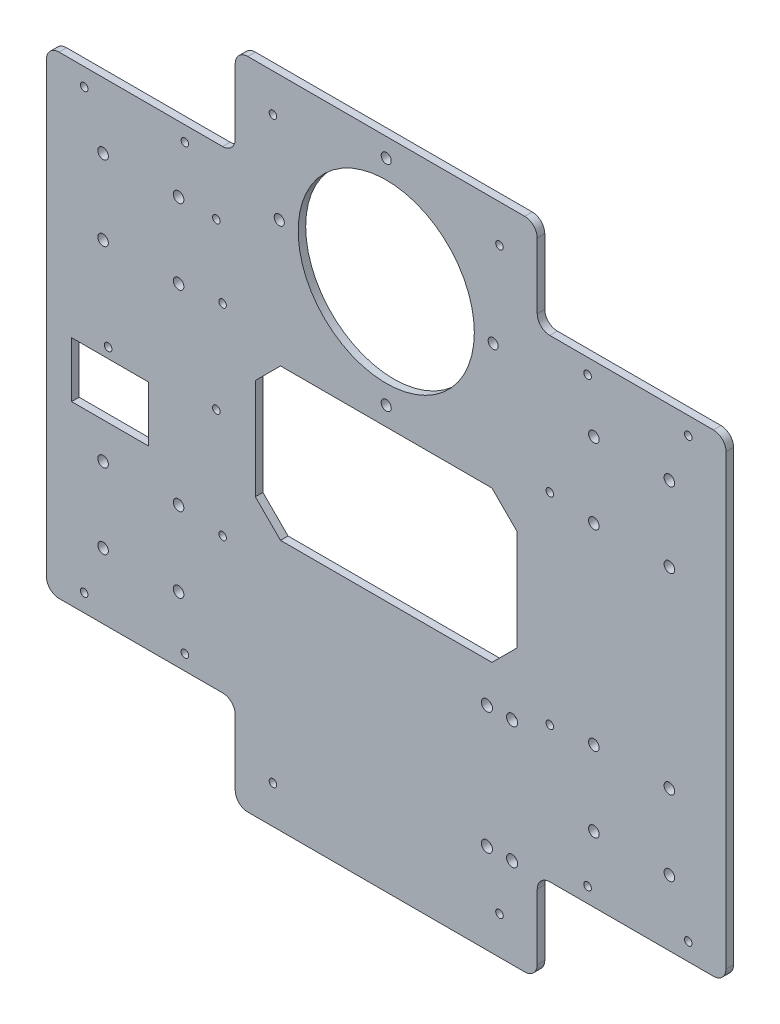
from build123d import *

# Parameters (mm, degrees)
SKETCH_1_W          = 270
SKETCH_1_H          = 260
EXTRUDE_1_DEPTH     = 3
CUT_EXTRUDE_1_REACH = 189.441
SKETCH_2_W          = 75
SKETCH_2_H          = 36
FILLET_1_R          = 5
SKETCH_3_R          = 35
CUT_EXTRUDE_2_DEPTH = 10
SKETCH_4_R          = 2.1
CUT_EXTRUDE_3_DEPTH = 4.55
SKETCH_5_R          = 1.5
SKETCH_5_R_2        = 2.2
CUT_EXTRUDE_4_DEPTH = 188.440657276
SKETCH_6_R          = 1.5
CUT_EXTRUDE_5_DEPTH = 188.440657276
SKETCH_7_R          = 1.5
CUT_EXTRUDE_6_DEPTH = 188.440657276
SKETCH_8_W          = 104
SKETCH_8_H          = 60
CUT_EXTRUDE_7_DEPTH = 188.440657276
CHAMFER_1_SIZE      = 10
SKETCH_9_R          = 2
CUT_EXTRUDE_8_DEPTH = 188.440657276
CUT_EXTRUDE_9_REACH = 189.441
SKETCH_11_W         = 30.5
SKETCH_11_H         = 22


with BuildPart() as part:
    # 草图1 → 凸台-拉伸1 (new body)
    with BuildSketch(Plane.XY):
        Rectangle(SKETCH_1_W, SKETCH_1_H)
    extrude(amount=EXTRUDE_1_DEPTH)

    # 草图2 → 切除-拉伸1 (cut, up to next)
    with BuildSketch(Plane.XY.offset(3), mode=Mode.PRIVATE) as cut_extrude_1_sk1:
        with Locations((97.5, -112)):
            Rectangle(SKETCH_2_W, SKETCH_2_H)
    cut_extrude_1_tool1 = extrude(cut_extrude_1_sk1.sketch, amount=-CUT_EXTRUDE_1_REACH, mode=Mode.PRIVATE) & part.part
    # 草图2 → 切除-拉伸1 (cut, up to next)
    with BuildSketch(Plane.XY.offset(3), mode=Mode.PRIVATE) as cut_extrude_1_sk2:
        with Locations((-97.5, -112)):
            Rectangle(SKETCH_2_W, SKETCH_2_H)
    cut_extrude_1_tool2 = extrude(cut_extrude_1_sk2.sketch, amount=-CUT_EXTRUDE_1_REACH, mode=Mode.PRIVATE) & part.part
    # 草图2 → 切除-拉伸1 (cut, up to next)
    with BuildSketch(Plane.XY.offset(3), mode=Mode.PRIVATE) as cut_extrude_1_sk3:
        with Locations((-97.5, 112)):
            Rectangle(SKETCH_2_W, SKETCH_2_H)
    cut_extrude_1_tool3 = extrude(cut_extrude_1_sk3.sketch, amount=-CUT_EXTRUDE_1_REACH, mode=Mode.PRIVATE) & part.part
    # 草图2 → 切除-拉伸1 (cut, up to next)
    with BuildSketch(Plane.XY.offset(3), mode=Mode.PRIVATE) as cut_extrude_1_sk4:
        with Locations((97.5, 112)):
            Rectangle(SKETCH_2_W, SKETCH_2_H)
    cut_extrude_1_tool4 = extrude(cut_extrude_1_sk4.sketch, amount=-CUT_EXTRUDE_1_REACH, mode=Mode.PRIVATE) & part.part
    add(cut_extrude_1_tool1.solids().sort_by_distance((97.5, -112, 3))[0], mode=Mode.SUBTRACT)
    add(cut_extrude_1_tool2.solids().sort_by_distance((-97.5, -112, 3))[0], mode=Mode.SUBTRACT)
    add(cut_extrude_1_tool3.solids().sort_by_distance((-97.5, 112, 3))[0], mode=Mode.SUBTRACT)
    add(cut_extrude_1_tool4.solids().sort_by_distance((97.5, 112, 3))[0], mode=Mode.SUBTRACT)

    # 圆角1
    fillet_1_edges = [part.edges().sort_by_distance(p)[0] for p in [
        (60, 130, 1.5),
        (135, 94, 1.5),
        (60, 94, 1.5),
        (-135, 94, 1.5),
        (-60, 130, 1.5),
        (-60, 94, 1.5),
        (-60, -130, 1.5),
        (-135, -94, 1.5),
        (-60, -94, 1.5),
        (135, -94, 1.5),
        (60, -130, 1.5),
        (60, -94, 1.5),
    ]]
    fillet(fillet_1_edges, radius=FILLET_1_R)

    # 草图3 → 切除-拉伸2 (cut)
    with BuildSketch(Plane.XY.offset(3)):
        with Locations((0, 80)):
            Circle(SKETCH_3_R)
    extrude(amount=-CUT_EXTRUDE_2_DEPTH, mode=Mode.SUBTRACT)

    # 草图4 → 切除-拉伸3 (cut)
    with BuildSketch(Plane(origin=(0, 0, 0), x_dir=(-1, 0, 0), z_dir=(0, 0, -1))):
        with Locations((-112.5, -38.1)):
            Circle(SKETCH_4_R)
        with Locations((-112.5, -67.9)):
            Circle(SKETCH_4_R)
        with Locations((-82.5, -38.1)):
            Circle(SKETCH_4_R)
        with Locations((-82.5, -67.9)):
            Circle(SKETCH_4_R)
        with Locations((-82.5, 67.9)):
            Circle(SKETCH_4_R)
        with Locations((-82.5, 38.1)):
            Circle(SKETCH_4_R)
        with Locations((-112.5, 67.9)):
            Circle(SKETCH_4_R)
        with Locations((-112.5, 38.1)):
            Circle(SKETCH_4_R)
        with Locations((112.5, 38.1)):
            Circle(SKETCH_4_R)
        with Locations((112.5, 67.9)):
            Circle(SKETCH_4_R)
        with Locations((82.5, 38.1)):
            Circle(SKETCH_4_R)
        with Locations((82.5, 67.9)):
            Circle(SKETCH_4_R)
        with Locations((82.5, -67.9)):
            Circle(SKETCH_4_R)
        with Locations((82.5, -38.1)):
            Circle(SKETCH_4_R)
        with Locations((112.5, -67.9)):
            Circle(SKETCH_4_R)
        with Locations((112.5, -38.1)):
            Circle(SKETCH_4_R)
    extrude(amount=-CUT_EXTRUDE_3_DEPTH, mode=Mode.SUBTRACT)

    # 草图5 → 切除-拉伸4 (cut, through all)
    with BuildSketch(Plane(origin=(0, 0, 0), x_dir=(-1, 0, 0), z_dir=(0, 0, -1))):
        with Locations((45, 115)):
            Circle(SKETCH_5_R)
        with Locations((120, 87)):
            Circle(SKETCH_5_R)
        with Locations((120, -87)):
            Circle(SKETCH_5_R)
        with Locations((45, -115)):
            Circle(SKETCH_5_R)
        with Locations((65, -40)):
            Circle(SKETCH_5_R)
        with Locations((65, 40)):
            Circle(SKETCH_5_R)
        with Locations(Location((-65, 40, 0), (0, 0, 180))):
            Circle(SKETCH_5_R)
        with Locations(Location((-65, -40, 0), (0, 0, 180))):
            Circle(SKETCH_5_R)
        with Locations(Location((-45, -115, 0), (0, 0, 180))):
            Circle(SKETCH_5_R)
        with Locations(Location((-120, -87, 0), (0, 0, 180))):
            Circle(SKETCH_5_R)
        with Locations(Location((-120, 87, 0), (0, 0, 180))):
            Circle(SKETCH_5_R)
        with Locations(Location((-45, 115, 0), (0, 0, 180))):
            Circle(SKETCH_5_R)
        with Locations((-50, -94.25)):
            Circle(SKETCH_5_R_2)
        with Locations((-40, -94.25)):
            Circle(SKETCH_5_R_2)
        with Locations((-50, -45.75)):
            Circle(SKETCH_5_R_2)
        with Locations((-40, -45.75)):
            Circle(SKETCH_5_R_2)
    extrude(amount=-CUT_EXTRUDE_4_DEPTH, mode=Mode.SUBTRACT)

    # 草图6 → 切除-拉伸5 (cut, through all)
    with BuildSketch(Plane.XY.offset(3)):
        with Locations((-110.5, 2.25)):
            Circle(SKETCH_6_R)
        with Locations((-67.5, 2.25)):
            Circle(SKETCH_6_R)
        with Locations((-67.5, 67.75)):
            Circle(SKETCH_6_R)
    extrude(amount=-CUT_EXTRUDE_5_DEPTH, mode=Mode.SUBTRACT)

    # 草图7 → 切除-拉伸6 (cut, through all)
    with BuildSketch(Plane(origin=(0, 0, 0), x_dir=(-1, 0, 0), z_dir=(0, 0, -1))):
        with Locations((80, 88)):
            Circle(SKETCH_7_R)
        with Locations(Location((-80, 88, 0), (0, 0, 180))):
            Circle(SKETCH_7_R)
        with Locations(Location((80, -88, 0), (0, 0, 180))):
            Circle(SKETCH_7_R)
        with Locations((-80, -88)):
            Circle(SKETCH_7_R)
    extrude(amount=-CUT_EXTRUDE_6_DEPTH, mode=Mode.SUBTRACT)

    # 草图8 → 切除-拉伸7 (cut, through all)
    with BuildSketch(Plane(origin=(0, 0, 0), x_dir=(-1, 0, 0), z_dir=(0, 0, -1))):
        Rectangle(SKETCH_8_W, SKETCH_8_H)
    extrude(amount=-CUT_EXTRUDE_7_DEPTH, mode=Mode.SUBTRACT)

    # 倒角1
    chamfer_1_edges = [part.edges().sort_by_distance(p)[0] for p in [
        (52, -30, 1.5),
        (52, 30, 1.5),
        (-52, 30, 1.5),
        (-52, -30, 1.5),
    ]]
    chamfer(chamfer_1_edges, length=CHAMFER_1_SIZE)

    # 草图9 → 切除-拉伸8 (cut, through all)
    with BuildSketch(Plane.XY.offset(3)):
        with Locations((42.5, 80)):
            Circle(SKETCH_9_R)
        with Locations((0, 37.5)):
            Circle(SKETCH_9_R)
        with Locations((-42.5, 80)):
            Circle(SKETCH_9_R)
        with Locations((0, 122.5)):
            Circle(SKETCH_9_R)
    extrude(amount=-CUT_EXTRUDE_8_DEPTH, mode=Mode.SUBTRACT)

    # 草图11 → 切除-拉伸9 (cut, up to next)
    with BuildSketch(Plane(origin=(0, 0, 0), x_dir=(-1, 0, 0), z_dir=(0, 0, -1)), mode=Mode.PRIVATE) as cut_extrude_9_sk1:
        with Locations((109.75, -12.761545207)):
            Rectangle(SKETCH_11_W, SKETCH_11_H)
    cut_extrude_9_tool1 = extrude(cut_extrude_9_sk1.sketch, amount=-CUT_EXTRUDE_9_REACH, mode=Mode.PRIVATE) & part.part
    add(cut_extrude_9_tool1.solids().sort_by_distance((-109.75, -12.761545, 0))[0], mode=Mode.SUBTRACT)


solid = part.part
